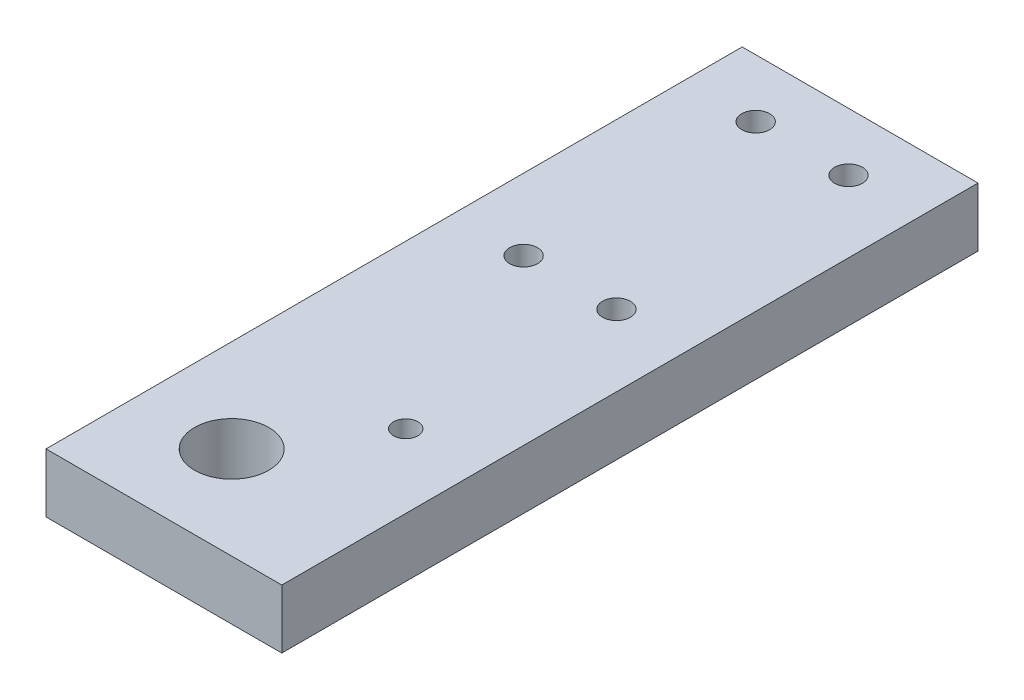
from build123d import *

# Parameters (mm, degrees)
SKETCH2_W           = 101.6
SKETCH2_H           = 300
BOSS_EXTRUDE1_DEPTH = 25.4
SKETCH3_R           = 6
CUT_EXTRUDE1_DEPTH  = 25.4
SKETCH4_R           = 16
CUT_EXTRUDE2_DEPTH  = 25.4
SKETCH5_R           = 5.25
CUT_EXTRUDE3_DEPTH  = 25.4


with BuildPart() as part:
    # Sketch2 → Boss-Extrude1 (new body)
    with BuildSketch(Plane(origin=(0, 0, 0), x_dir=(1, 0, 0), z_dir=(0, 1, 0))):
        with Locations((50.8, 150)):
            Rectangle(SKETCH2_W, SKETCH2_H)
    extrude(amount=BOSS_EXTRUDE1_DEPTH)

    # Sketch3 → Cut-Extrude1 (cut)
    with BuildSketch(Plane(origin=(0, 25.4, 0), x_dir=(1, 0, 0), z_dir=(0, 1, 0))):
        with Locations(Location((70.8, 275, 0), (0, 0, 270))):
            Circle(SKETCH3_R)
        with Locations(Location((30.8, 275, 0), (0, 0, 270))):
            Circle(SKETCH3_R)
        with Locations(Location((30.8, 175, 0), (0, 0, 270))):
            Circle(SKETCH3_R)
        with Locations(Location((70.8, 175, 0), (0, 0, 270))):
            Circle(SKETCH3_R)
    extrude(amount=-CUT_EXTRUDE1_DEPTH, mode=Mode.SUBTRACT)

    # Sketch4 → Cut-Extrude2 (cut)
    with BuildSketch(Plane(origin=(0, 25.4, 0), x_dir=(1, 0, 0), z_dir=(0, 1, 0))):
        with Locations(Location((40, 40, 0), (0, 0, 270))):
            Circle(SKETCH4_R)
    extrude(amount=-CUT_EXTRUDE2_DEPTH, mode=Mode.SUBTRACT)

    # Sketch5 → Cut-Extrude3 (cut)
    with BuildSketch(Plane(origin=(0, 25.4, 0), x_dir=(1, 0, 0), z_dir=(0, 1, 0))):
        with Locations(Location((70, 85, 0), (0, 0, 270))):
            Circle(SKETCH5_R)
    extrude(amount=-CUT_EXTRUDE3_DEPTH, mode=Mode.SUBTRACT)


solid = part.part
